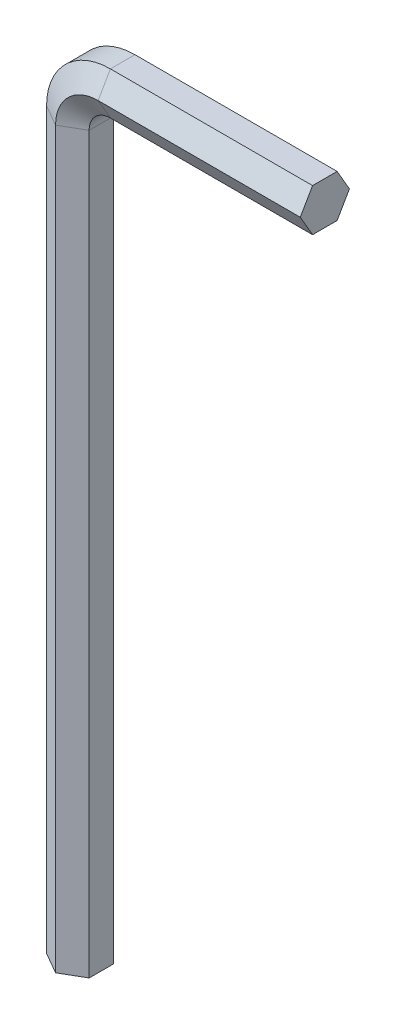
from build123d import *


with BuildPart() as part:
    # Sweep1: sweep along a path in Sketch1
    with BuildLine(Plane.XY) as sweep1_path:
        Line((0, 0), (-19, 0))
        ThreePointArc((-19, 0), (-23.242640687, -1.757359313), (-25, -6))
        Line((-25, -6), (-25, -75))
    # Sketch2 → Sweep1 (sweep)
    with BuildSketch(Plane(origin=(0, 0, 0), x_dir=(0, 0, -1), z_dir=(1, 0, 0))):
        Polygon((2.309401077, -2), (1.154700538, 0), (-1.154700538, 0), (-2.309401077, -2), (-1.154700538, -4), (1.154700538, -4), align=None)
    sweep(path=sweep1_path.line)


solid = part.part
